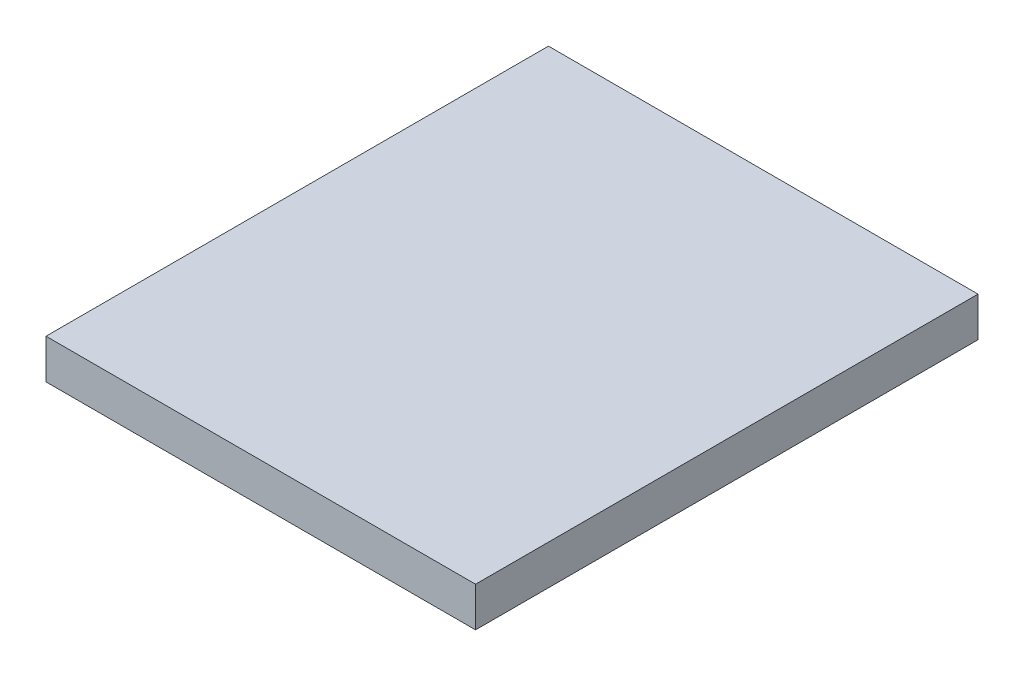
from build123d import *

# Parameters (mm, degrees)
SKETCH1_W           = 152
SKETCH1_H           = 177.8
BOSS_EXTRUDE1_DEPTH = 14


with BuildPart() as part:
    # Sketch1 → Boss-Extrude1 (new body)
    with BuildSketch(Plane(origin=(0, 0, 0), x_dir=(1, 0, 0), z_dir=(0, 1, 0))):
        Rectangle(SKETCH1_W, SKETCH1_H)
    extrude(amount=BOSS_EXTRUDE1_DEPTH)


solid = part.part
